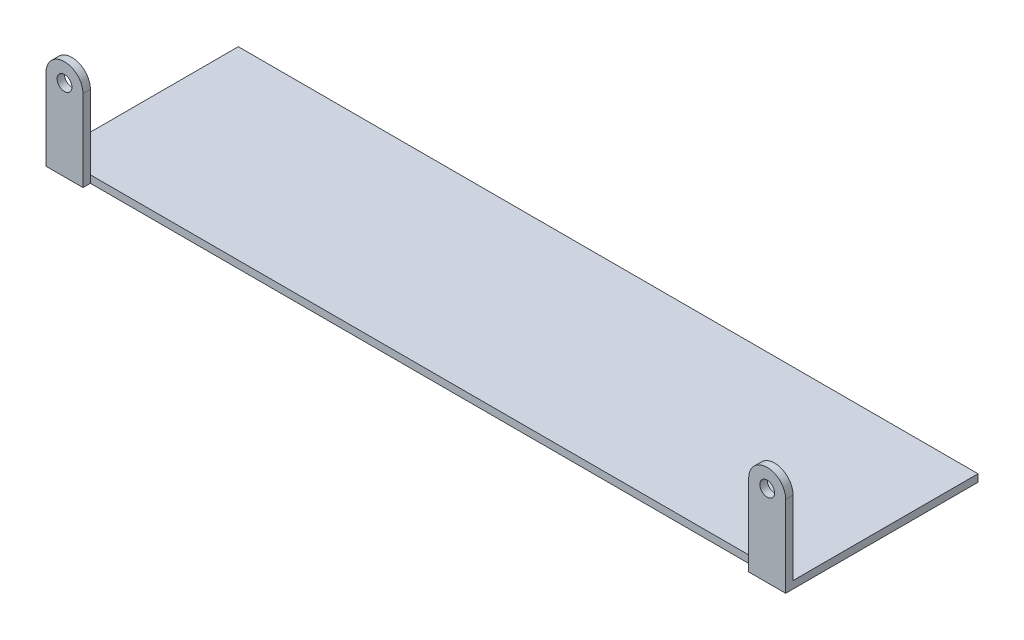
from build123d import *

# Parameters (mm, degrees)
SKETCH3_W           = 200
SKETCH3_H           = 50
BOSS_EXTRUDE2_DEPTH = 1
SKETCH4_R           = 2
BOSS_EXTRUDE3_DEPTH = 2


with BuildPart() as part:
    # Sketch3 → Boss-Extrude2 (new, symmetric)
    with BuildSketch(Plane(origin=(0, 0, 0), x_dir=(1, 0, 0), z_dir=(0, 1, 0))):
        Rectangle(SKETCH3_W, SKETCH3_H)
    extrude(amount=BOSS_EXTRUDE2_DEPTH, both=True)

    # Sketch4 → Boss-Extrude3 (add)
    # profile 1 of 2: a face of its own
    with BuildSketch(Plane.XY.offset(25)):
        with BuildLine():
            Line((100, -1), (90, -1))
            Line((90, -1), (90, 21))
            ThreePointArc((90, 21), (95, 26), (100, 21))
            Line((100, 21), (100, -1))
        make_face()
        with Locations((95, 21)):
            Circle(SKETCH4_R, mode=Mode.SUBTRACT)
    # profile 2 of 2: a face of its own
    with BuildSketch(Plane.XY.offset(25)):
        with BuildLine():
            Line((-90, -1), (-90, 21))
            ThreePointArc((-90, 21), (-95, 26), (-100, 21))
            Line((-100, 21), (-100, -1))
            Line((-100, -1), (-90, -1))
        make_face()
        with Locations(Location((-95, 21, 0), (0, 0, 180))):
            Circle(SKETCH4_R, mode=Mode.SUBTRACT)
    extrude(amount=BOSS_EXTRUDE3_DEPTH)


solid = part.part
